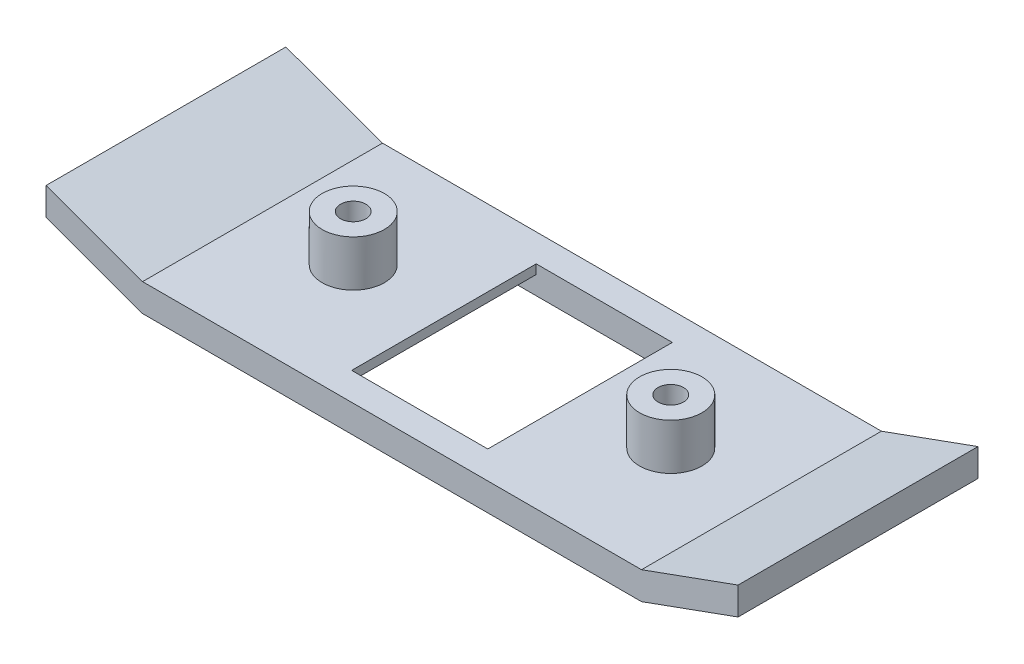
from build123d import *

# Parameters (mm, degrees)
BOSS_EXTRUDE1_DEPTH = 26
SKETCH2_W           = 75
SKETCH2_H           = 20
CUT_EXTRUDE1_DEPTH  = 1
SKETCH4_W           = 75
SKETCH4_H           = 20
CUT_EXTRUDE2_DEPTH  = 1
SKETCH5_W           = 14.75
SKETCH5_H           = 20
CUT_EXTRUDE3_DEPTH  = 46.882459228
SKETCH6_R           = 3.375
SKETCH6_R_2         = 1.375
BOSS_EXTRUDE2_DEPTH = 5


with BuildPart() as part:
    # Sketch1 → Boss-Extrude1 (new body)
    with BuildSketch(Plane.XY):
        Polygon((27.035253752, 0), (-27.035253752, 0), (-37.5, 3.790622591), (-37.5, 6.790622591), (-27.035253752, 3), (27.035253752, 3), (37.5, 6.790622591), (37.5, 3.790622591), align=None)
    extrude(amount=BOSS_EXTRUDE1_DEPTH)

    # Sketch2 → Cut-Extrude1 (cut)
    with BuildSketch(Plane.XZ):
        with Locations((0, 13)):
            Rectangle(SKETCH2_W, SKETCH2_H)
    extrude(amount=-CUT_EXTRUDE1_DEPTH, mode=Mode.SUBTRACT)

    # Sketch4 → Cut-Extrude2 (cut)
    with BuildSketch(Plane.XZ.offset(-1)):
        with Locations((0, 13)):
            Rectangle(SKETCH4_W, SKETCH4_H)
    extrude(amount=-CUT_EXTRUDE2_DEPTH, mode=Mode.SUBTRACT)

    # Sketch5 → Cut-Extrude3 (cut, through all)
    with BuildSketch(Plane.XZ.offset(-2)):
        with Locations((0, 13)):
            Rectangle(SKETCH5_W, SKETCH5_H)
    extrude(amount=-CUT_EXTRUDE3_DEPTH, mode=Mode.SUBTRACT)

    # Sketch6 → Boss-Extrude2 (add)
    # profile 1 of 2: a face of its own
    with BuildSketch(Plane(origin=(0, 3, 0), x_dir=(1, 0, 0), z_dir=(0, 1, 0))):
        with Locations(Location((-17.205126876, -13, 0), (0, 0, 90))):
            Circle(SKETCH6_R)
        with Locations(Location((-17.205126876, -13, 0), (0, 0, 270))):
            Circle(SKETCH6_R_2, mode=Mode.SUBTRACT)
    # profile 2 of 2: a face of its own
    with BuildSketch(Plane(origin=(0, 3, 0), x_dir=(1, 0, 0), z_dir=(0, 1, 0))):
        with Locations(Location((17.205126876, -13, 0), (0, 0, 90))):
            Circle(SKETCH6_R)
        with Locations(Location((17.205126876, -13, 0), (0, 0, 90))):
            Circle(SKETCH6_R_2, mode=Mode.SUBTRACT)
    extrude(amount=BOSS_EXTRUDE2_DEPTH)


solid = part.part
